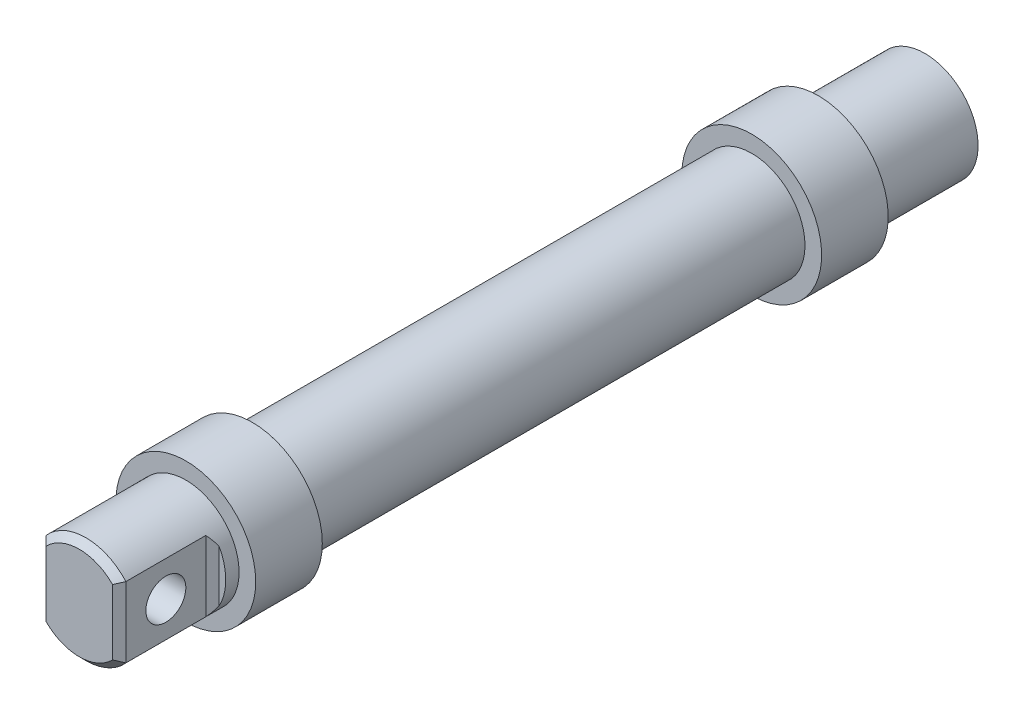
from build123d import *

# Parameters (mm, degrees)
ESQUISSE1_R                  = 10.5
BOSS_EXTRU_1_DEPTH           = 10
ESQUISSE2_R                  = 8
BOSS_EXTRU_2_DEPTH           = 16
ESQUISSE3_W                  = 2
ESQUISSE3_H                  = 16
ENL_V_MAT_EXTRU_1_DEPTH      = 14
CHANFREIN1_SIZE              = 1
ENL_V_MAT_EXTRU_2_DEPTH      = 33.53459697
ENL_V_MAT_EXTRU_2_DEPTH_BACK = 33.53459697
ESQUISSE4_R                  = 3
BOSS_EXTRU_3_START           = 85
ESQUISSE5_R                  = 8
BOSS_EXTRU_3_DEPTH           = 85
ESQUISSE6_R                  = 10.5
BOSS_EXTRU_4_DEPTH           = 10
BOSS_EXTRU_5_START           = 16
ESQUISSE7_R                  = 8
BOSS_EXTRU_5_DEPTH           = 16
ESQUISSE8_R                  = 3
ENL_V_MAT_EXTRU_3_DEPTH      = 98


with BuildPart() as part:
    # Esquisse1 → Boss.-Extru.1 (new body)
    with BuildSketch(Plane.XY):
        Circle(ESQUISSE1_R)
    extrude(amount=BOSS_EXTRU_1_DEPTH)

    # Esquisse2 → Boss.-Extru.2 (add)
    with BuildSketch(Plane.XY.offset(10)):
        Circle(ESQUISSE2_R)
    extrude(amount=BOSS_EXTRU_2_DEPTH)

    # Esquisse3 → Enlèv. mat.-Extru.1 (cut)
    with BuildSketch(Plane.XY.offset(26)):
        with Locations((-7, 0)):
            Rectangle(ESQUISSE3_W, ESQUISSE3_H)
        with Locations((7, 0)):
            Rectangle(ESQUISSE3_W, ESQUISSE3_H)
    extrude(amount=-ENL_V_MAT_EXTRU_1_DEPTH, mode=Mode.SUBTRACT)

    # Chanfrein1
    chanfrein1_edges = [part.edges().sort_by_distance(p)[0] for p in [
        (0, -8, 26),
        (-6, 0, 26),
        (-6, 0, 12),
        (0, 8, 26),
        (6, 0, 26),
        (6, 0, 12),
    ]]
    chamfer(chanfrein1_edges, length=CHANFREIN1_SIZE)

    # Esquisse4 → Enlèv. mat.-Extru.2 (cut, two sides: drawn at the far end of the back side and taken through both)
    with BuildSketch(Plane.ZY.offset(6).offset(-ENL_V_MAT_EXTRU_2_DEPTH_BACK)):
        with Locations((19, 0)):
            Circle(ESQUISSE4_R)
    extrude(amount=ENL_V_MAT_EXTRU_2_DEPTH + ENL_V_MAT_EXTRU_2_DEPTH_BACK, mode=Mode.SUBTRACT)

    # Esquisse5 → Boss.-Extru.3 (add)
    with BuildSketch(Plane(origin=(0, 0, 0), x_dir=(-1, 0, 0), z_dir=(0, 0, -1)).offset(BOSS_EXTRU_3_START)):
        with Locations(Location((0, 0, 0), (0, 0, 28.955024372))):
            Circle(ESQUISSE5_R)
    extrude(amount=-BOSS_EXTRU_3_DEPTH)

    # Esquisse6 → Boss.-Extru.4 (add)
    with BuildSketch(Plane(origin=(0, 0, -85), x_dir=(-1, 0, 0), z_dir=(0, 0, -1))):
        with Locations(Location((0, 0, 0), (0, 0, 180))):
            Circle(ESQUISSE6_R)
    extrude(amount=-BOSS_EXTRU_4_DEPTH)

    # Esquisse7 → Boss.-Extru.5 (add)
    with BuildSketch(Plane(origin=(0, 0, -85), x_dir=(-1, 0, 0), z_dir=(0, 0, -1)).offset(BOSS_EXTRU_5_START)):
        with Locations(Location((0, 0, 0), (0, 0, 180))):
            Circle(ESQUISSE7_R)
    extrude(amount=-BOSS_EXTRU_5_DEPTH)

    # Esquisse8 → Enlèv. mat.-Extru.3 (cut)
    with BuildSketch(Plane(origin=(0, 0, -101), x_dir=(-1, 0, 0), z_dir=(0, 0, -1))):
        Circle(ESQUISSE8_R)
    extrude(amount=-ENL_V_MAT_EXTRU_3_DEPTH, mode=Mode.SUBTRACT)


solid = part.part
